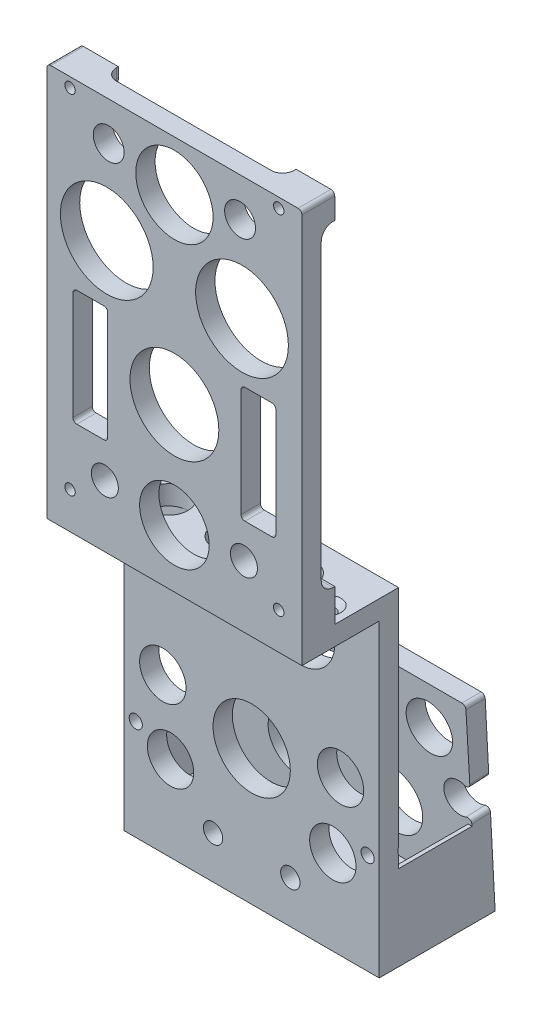
from build123d import *

# Parameters (mm, degrees)
BOSS_EXTRUDE1_DEPTH                            = 33
BOSS_EXTRUDE1_DEPTH_BACK                       = 33
CSK_FOR_M3_COUNTERSUNK_FLAT_HEAD_SCR_2_COUNT   = 2
CSK_FOR_M3_COUNTERSUNK_FLAT_HEAD_SCR_2_PITCH   = 60
CUT_EXTRUDE1_REACH                             = 192.096
SKETCH4_R                                      = 4
SKETCH4_R_2                                    = 10
SKETCH4_R_3                                    = 6
SKETCH4_R_4                                    = 7.5
CUT_EXTRUDE2_REACH                             = 108.761
SKETCH5_R                                      = 5
CUT_EXTRUDE3_REACH                             = 193.606
SKETCH6_W                                      = 9
SKETCH6_H                                      = 30
BOSS_EXTRUDE2_DEPTH                            = 3.5
FILLET1_R                                      = 3
FILLET1_OF_MIRROR1_R                           = 3
SKETCH9_R                                      = 1.35
CUT_EXTRUDE4_DEPTH                             = 190.565951584
CUT_EXTRUDE5_REACH                             = 188.649
SKETCH10_R                                     = 10
SKETCH10_R_2                                   = 6
SKETCH10_R_3                                   = 9
SKETCH10_R_4                                   = 2.5
CUT_EXTRUDE6_REACH                             = 193.606
SKETCH11_R                                     = 10
SKETCH11_R_2                                   = 11.5
SKETCH11_R_3                                   = 12
SKETCH11_R_4                                   = 9
SKETCH11_R_5                                   = 4
SKETCH11_R_6                                   = 3.5
FILLET2_R                                      = 1
FILLET3_R                                      = 1
FRAISAGE_POUR_VIS_T_TE_FRAIS_E_M31_D           = 3.4
FRAISAGE_POUR_VIS_T_TE_FRAIS_E_M31_CSINK_D     = 6.3
FRAISAGE_POUR_VIS_T_TE_FRAIS_E_M31_CSINK_ANGLE = 90
BOSS_EXTRU_1_DEPTH                             = 1


with BuildPart() as part:
    # Sketch1 → Boss-Extrude1 (new, two sides: drawn at the far end of the back side and taken through both)
    with BuildSketch(Plane(origin=(0, 0, 0), x_dir=(0, 0, -1), z_dir=(1, 0, 0)).offset(-BOSS_EXTRUDE1_DEPTH_BACK)):
        Polygon((0, 0), (30, 0), (27.383202188, 49.931476738), (22.383202188, 49.931476738), (25, 5), (5, 5), (5, 85), (-15, 85), (-15, 182), (-20, 182), (-20, 80), (0, 80), align=None)
    extrude(amount=BOSS_EXTRUDE1_DEPTH + BOSS_EXTRUDE1_DEPTH_BACK)

    # Sketch2 → CSK for M3 Countersunk Flat Head Screw1 (revolve, cut)
    with BuildSketch(Plane(origin=(30, 26, -5), x_dir=(0, 1, 0), z_dir=(1, 0, 0))):
        Polygon((0, 0), (0, 25), (1.7, 25), (1.7, 1.45), (3.15, 0), align=None)
    csk_for_m3_countersunk_flat_head_screw1 = revolve(axis=Axis((30, 26, -11.35), (0, 0, 1)), mode=Mode.SUBTRACT)

    # CSK for M3 Countersunk Flat Head Scr 2: CSK for M3 Countersunk Flat Head Screw1 ×2
    with Locations(*[(-i * CSK_FOR_M3_COUNTERSUNK_FLAT_HEAD_SCR_2_PITCH, 0, 0) for i in range(1, CSK_FOR_M3_COUNTERSUNK_FLAT_HEAD_SCR_2_COUNT)]):
        add(csk_for_m3_countersunk_flat_head_screw1, mode=Mode.SUBTRACT)

    # Cut-Extrude1: up to this plane
    cut_extrude1_end = Plane(origin=(-33, 49.931476738, -22.383202188), z_dir=(0, -0.058141226221753155, 0.9983083680974687))
    # Sketch4 → Cut-Extrude1 (cut, up to the surface)
    with BuildSketch(Plane(origin=(0, 1.567926949, -29.917828431), x_dir=(-1, 0, 0), z_dir=(0, 0.05233595624294443, -0.9986295347545739)), mode=Mode.PRIVATE) as cut_extrude1_sk1:
        with Locations((-30, 25.778575259)):
            Circle(SKETCH4_R)
    cut_extrude1_tool1 = split(extrude(cut_extrude1_sk1.sketch, amount=-CUT_EXTRUDE1_REACH, mode=Mode.PRIVATE), bisect_by=cut_extrude1_end, keep=Keep.BOTH, mode=Mode.PRIVATE)
    add(cut_extrude1_tool1.solids().sort_by_distance((30, 27.311174, -28.568682))[0], mode=Mode.SUBTRACT)
    # Sketch4 → Cut-Extrude1 (cut, up to the surface)
    with BuildSketch(Plane(origin=(0, 1.567926949, -29.917828431), x_dir=(-1, 0, 0), z_dir=(0, 0.05233595624294443, -0.9986295347545739)), mode=Mode.PRIVATE) as cut_extrude1_sk2:
        with Locations((30, 25.778575259)):
            Circle(SKETCH4_R)
    cut_extrude1_tool2 = split(extrude(cut_extrude1_sk2.sketch, amount=-CUT_EXTRUDE1_REACH, mode=Mode.PRIVATE), bisect_by=cut_extrude1_end, keep=Keep.BOTH, mode=Mode.PRIVATE)
    add(cut_extrude1_tool2.solids().sort_by_distance((-30, 27.311174, -28.568682))[0], mode=Mode.SUBTRACT)
    # Sketch4 → Cut-Extrude1 (cut, up to the surface)
    with BuildSketch(Plane(origin=(0, 1.567926949, -29.917828431), x_dir=(-1, 0, 0), z_dir=(0, 0.05233595624294443, -0.9986295347545739)), mode=Mode.PRIVATE) as cut_extrude1_sk3:
        with Locations(Location((0, 33.429921313, 0), (0, 0, 90))):
            Circle(SKETCH4_R_2)
    cut_extrude1_tool3 = split(extrude(cut_extrude1_sk3.sketch, amount=-CUT_EXTRUDE1_REACH, mode=Mode.PRIVATE), bisect_by=cut_extrude1_end, keep=Keep.BOTH, mode=Mode.PRIVATE)
    add(cut_extrude1_tool3.solids().sort_by_distance((0, 34.952034, -28.168242))[0], mode=Mode.SUBTRACT)
    # Sketch4 → Cut-Extrude1 (cut, up to the surface)
    with BuildSketch(Plane(origin=(0, 1.567926949, -29.917828431), x_dir=(-1, 0, 0), z_dir=(0, 0.05233595624294443, -0.9986295347545739)), mode=Mode.PRIVATE) as cut_extrude1_sk4:
        with Locations(Location((-23, 38.429921313, 0), (0, 0, 90))):
            Circle(SKETCH4_R_3)
    cut_extrude1_tool4 = split(extrude(cut_extrude1_sk4.sketch, amount=-CUT_EXTRUDE1_REACH, mode=Mode.PRIVATE), bisect_by=cut_extrude1_end, keep=Keep.BOTH, mode=Mode.PRIVATE)
    add(cut_extrude1_tool4.solids().sort_by_distance((23, 39.945181, -27.906562))[0], mode=Mode.SUBTRACT)
    # Sketch4 → Cut-Extrude1 (cut, up to the surface)
    with BuildSketch(Plane(origin=(0, 1.567926949, -29.917828431), x_dir=(-1, 0, 0), z_dir=(0, 0.05233595624294443, -0.9986295347545739)), mode=Mode.PRIVATE) as cut_extrude1_sk5:
        with Locations(Location((23, 38.429921313, 0), (0, 0, 90))):
            Circle(SKETCH4_R_3)
    cut_extrude1_tool5 = split(extrude(cut_extrude1_sk5.sketch, amount=-CUT_EXTRUDE1_REACH, mode=Mode.PRIVATE), bisect_by=cut_extrude1_end, keep=Keep.BOTH, mode=Mode.PRIVATE)
    add(cut_extrude1_tool5.solids().sort_by_distance((-23, 39.945181, -27.906562))[0], mode=Mode.SUBTRACT)
    # Sketch4 → Cut-Extrude1 (cut, up to the surface)
    with BuildSketch(Plane(origin=(0, 1.567926949, -29.917828431), x_dir=(-1, 0, 0), z_dir=(0, 0.05233595624294443, -0.9986295347545739)), mode=Mode.PRIVATE) as cut_extrude1_sk6:
        with Locations(Location((12.5, 16.429921313, 0), (0, 0, 90))):
            Circle(SKETCH4_R_4)
    cut_extrude1_tool6 = split(extrude(cut_extrude1_sk6.sketch, amount=-CUT_EXTRUDE1_REACH, mode=Mode.PRIVATE), bisect_by=cut_extrude1_end, keep=Keep.BOTH, mode=Mode.PRIVATE)
    add(cut_extrude1_tool6.solids().sort_by_distance((-12.5, 17.975332, -29.057953))[0], mode=Mode.SUBTRACT)
    # Sketch4 → Cut-Extrude1 (cut, up to the surface)
    with BuildSketch(Plane(origin=(0, 1.567926949, -29.917828431), x_dir=(-1, 0, 0), z_dir=(0, 0.05233595624294443, -0.9986295347545739)), mode=Mode.PRIVATE) as cut_extrude1_sk7:
        with Locations(Location((-12.5, 16.429921313, 0), (0, 0, 90))):
            Circle(SKETCH4_R_4)
    cut_extrude1_tool7 = split(extrude(cut_extrude1_sk7.sketch, amount=-CUT_EXTRUDE1_REACH, mode=Mode.PRIVATE), bisect_by=cut_extrude1_end, keep=Keep.BOTH, mode=Mode.PRIVATE)
    add(cut_extrude1_tool7.solids().sort_by_distance((12.5, 17.975332, -29.057953))[0], mode=Mode.SUBTRACT)
    # Sketch4 → Cut-Extrude1 (cut, up to the surface)
    with BuildSketch(Plane(origin=(0, 1.567926949, -29.917828431), x_dir=(-1, 0, 0), z_dir=(0, 0.05233595624294443, -0.9986295347545739)), mode=Mode.PRIVATE) as cut_extrude1_sk8:
        with Locations(Location((0, 8.429921313, 0), (0, 0, 90))):
            Circle(SKETCH4_R)
    cut_extrude1_tool8 = split(extrude(cut_extrude1_sk8.sketch, amount=-CUT_EXTRUDE1_REACH, mode=Mode.PRIVATE), bisect_by=cut_extrude1_end, keep=Keep.BOTH, mode=Mode.PRIVATE)
    add(cut_extrude1_tool8.solids().sort_by_distance((0, 9.986295, -29.47664))[0], mode=Mode.SUBTRACT)

    # Sketch5 → Cut-Extrude2 (cut, up to next)
    with BuildSketch(Plane(origin=(0, 85, 0), x_dir=(1, 0, 0), z_dir=(0, 1, 0)), mode=Mode.PRIVATE) as cut_extrude2_sk1:
        with Locations(Location((16.5, -5, 0), (0, 0, 270))):
            Circle(SKETCH5_R)
    cut_extrude2_tool1 = extrude(cut_extrude2_sk1.sketch, amount=-CUT_EXTRUDE2_REACH, mode=Mode.PRIVATE) & part.part
    # Sketch5 → Cut-Extrude2 (cut, up to next)
    with BuildSketch(Plane(origin=(0, 85, 0), x_dir=(1, 0, 0), z_dir=(0, 1, 0)), mode=Mode.PRIVATE) as cut_extrude2_sk2:
        with Locations(Location((-16.5, -5, 0), (0, 0, 270))):
            Circle(SKETCH5_R)
    cut_extrude2_tool2 = extrude(cut_extrude2_sk2.sketch, amount=-CUT_EXTRUDE2_REACH, mode=Mode.PRIVATE) & part.part
    # Sketch5 → Cut-Extrude2 (cut, up to next)
    with BuildSketch(Plane(origin=(0, 85, 0), x_dir=(1, 0, 0), z_dir=(0, 1, 0)), mode=Mode.PRIVATE) as cut_extrude2_sk3:
        with Locations(Location((0, -5, 0), (0, 0, 270))):
            Circle(SKETCH5_R)
    cut_extrude2_tool3 = extrude(cut_extrude2_sk3.sketch, amount=-CUT_EXTRUDE2_REACH, mode=Mode.PRIVATE) & part.part
    add(cut_extrude2_tool1.solids().sort_by_distance((16.5, 85, 5))[0], mode=Mode.SUBTRACT)
    add(cut_extrude2_tool2.solids().sort_by_distance((-16.5, 85, 5))[0], mode=Mode.SUBTRACT)
    add(cut_extrude2_tool3.solids().sort_by_distance((0, 85, 5))[0], mode=Mode.SUBTRACT)

    # Sketch6 → Cut-Extrude3 (cut, up to next)
    with BuildSketch(Plane.XY.offset(20), mode=Mode.PRIVATE) as cut_extrude3_sk1:
        with Locations((21.75, 120)):
            Rectangle(SKETCH6_W, SKETCH6_H)
    cut_extrude3_tool1 = extrude(cut_extrude3_sk1.sketch, amount=-CUT_EXTRUDE3_REACH, mode=Mode.PRIVATE) & part.part
    # Sketch6 → Cut-Extrude3 (cut, up to next)
    with BuildSketch(Plane.XY.offset(20), mode=Mode.PRIVATE) as cut_extrude3_sk2:
        with Locations((-21.75, 120)):
            Rectangle(SKETCH6_W, SKETCH6_H)
    cut_extrude3_tool2 = extrude(cut_extrude3_sk2.sketch, amount=-CUT_EXTRUDE3_REACH, mode=Mode.PRIVATE) & part.part
    add(cut_extrude3_tool1.solids().sort_by_distance((21.75, 120, 20))[0], mode=Mode.SUBTRACT)
    add(cut_extrude3_tool2.solids().sort_by_distance((-21.75, 120, 20))[0], mode=Mode.SUBTRACT)

    # Sketch8 → Boss-Extrude2 (add)
    with BuildSketch(Plane(origin=(0, 0, 15), x_dir=(-1, 0, 0), z_dir=(0, 0, -1))):
        with BuildLine():
            Line((-33, 85), (-23, 85))
            Line((-23, 85), (-23, 89.5))
            ThreePointArc((-23, 89.5), (-24.171572875, 92.328427125), (-27, 93.5))
            Line((-27, 93.5), (-33, 93.5))
            Line((-33, 93.5), (-33, 85))
        make_face()
        with BuildLine():
            Line((-33, 175.5), (-27, 175.5))
            ThreePointArc((-27, 175.5), (-24.171572875, 176.671572875), (-23, 179.5))
            Line((-23, 179.5), (-23, 182))
            Line((-23, 182), (-33, 182))
            Line((-33, 182), (-33, 175.5))
        make_face()
    boss_extrude2 = extrude(amount=BOSS_EXTRUDE2_DEPTH)

    # Fillet1
    fillet1_edges = [part.edges().sort_by_distance(p)[0] for p in [
        (30, 93.5, 15),
        (24.171572875, 92.328427125, 15),
        (23, 87.25, 15),
        (23, 180.75, 15),
        (24.171572875, 176.671572875, 15),
        (30, 175.5, 15),
    ]]
    fillet(fillet1_edges, radius=FILLET1_R)

    # Mirror1: Boss-Extrude2 across plane
    add(boss_extrude2.mirror(Plane(origin=(0, 0, 0), x_dir=(0, 0, 1), z_dir=(1, 0, 0))))

    # Fillet1 of Mirror1
    fillet1_of_mirror1_edges = [part.edges().sort_by_distance(p)[0] for p in [
        (-30, 93.5, 15),
        (-24.171572875, 92.328427125, 15),
        (-23, 87.25, 15),
        (-23, 180.75, 15),
        (-24.171572875, 176.671572875, 15),
        (-30, 175.5, 15),
    ]]
    fillet(fillet1_of_mirror1_edges, radius=FILLET1_OF_MIRROR1_R)

    # Sketch9 → Cut-Extrude4 (cut, through all)
    with BuildSketch(Plane(origin=(0, 0, 11.5), x_dir=(-1, 0, 0), z_dir=(0, 0, -1))):
        with Locations(Location((27, 89.5, 0), (0, 0, 90))):
            Circle(SKETCH9_R)
        with Locations(Location((-27, 89.5, 0), (0, 0, 90))):
            Circle(SKETCH9_R)
        with Locations(Location((-27, 179.5, 0), (0, 0, 90))):
            Circle(SKETCH9_R)
        with Locations(Location((27, 179.5, 0), (0, 0, 90))):
            Circle(SKETCH9_R)
    extrude(amount=-CUT_EXTRUDE4_DEPTH, mode=Mode.SUBTRACT)

    # Sketch10 → Cut-Extrude5 (cut, up to next)
    with BuildSketch(Plane(origin=(0, 0, -5), x_dir=(-1, 0, 0), z_dir=(0, 0, -1)), mode=Mode.PRIVATE) as cut_extrude5_sk1:
        with Locations((0, 34.952033716)):
            Circle(SKETCH10_R)
    cut_extrude5_tool1 = extrude(cut_extrude5_sk1.sketch, amount=-CUT_EXTRUDE5_REACH, mode=Mode.PRIVATE) & part.part
    # Sketch10 → Cut-Extrude5 (cut, up to next)
    with BuildSketch(Plane(origin=(0, 0, -5), x_dir=(-1, 0, 0), z_dir=(0, 0, -1)), mode=Mode.PRIVATE) as cut_extrude5_sk2:
        with Locations((-23, 39.94518139)):
            Circle(SKETCH10_R_2)
    cut_extrude5_tool2 = extrude(cut_extrude5_sk2.sketch, amount=-CUT_EXTRUDE5_REACH, mode=Mode.PRIVATE) & part.part
    # Sketch10 → Cut-Extrude5 (cut, up to next)
    with BuildSketch(Plane(origin=(0, 0, -5), x_dir=(-1, 0, 0), z_dir=(0, 0, -1)), mode=Mode.PRIVATE) as cut_extrude5_sk3:
        with Locations((23, 39.94518139)):
            Circle(SKETCH10_R_2)
    cut_extrude5_tool3 = extrude(cut_extrude5_sk3.sketch, amount=-CUT_EXTRUDE5_REACH, mode=Mode.PRIVATE) & part.part
    # Sketch10 → Cut-Extrude5 (cut, up to next)
    with BuildSketch(Plane(origin=(0, 0, -5), x_dir=(-1, 0, 0), z_dir=(0, 0, -1)), mode=Mode.PRIVATE) as cut_extrude5_sk4:
        with Locations((-12.5, 69)):
            Circle(SKETCH10_R_3)
    cut_extrude5_tool4 = extrude(cut_extrude5_sk4.sketch, amount=-CUT_EXTRUDE5_REACH, mode=Mode.PRIVATE) & part.part
    # Sketch10 → Cut-Extrude5 (cut, up to next)
    with BuildSketch(Plane(origin=(0, 0, -5), x_dir=(-1, 0, 0), z_dir=(0, 0, -1)), mode=Mode.PRIVATE) as cut_extrude5_sk5:
        with Locations((12.5, 69)):
            Circle(SKETCH10_R_3)
    cut_extrude5_tool5 = extrude(cut_extrude5_sk5.sketch, amount=-CUT_EXTRUDE5_REACH, mode=Mode.PRIVATE) & part.part
    # Sketch10 → Cut-Extrude5 (cut, up to next)
    with BuildSketch(Plane(origin=(0, 0, -5), x_dir=(-1, 0, 0), z_dir=(0, 0, -1)), mode=Mode.PRIVATE) as cut_extrude5_sk6:
        with Locations((-21, 22)):
            Circle(SKETCH10_R_2)
    cut_extrude5_tool6 = extrude(cut_extrude5_sk6.sketch, amount=-CUT_EXTRUDE5_REACH, mode=Mode.PRIVATE) & part.part
    # Sketch10 → Cut-Extrude5 (cut, up to next)
    with BuildSketch(Plane(origin=(0, 0, -5), x_dir=(-1, 0, 0), z_dir=(0, 0, -1)), mode=Mode.PRIVATE) as cut_extrude5_sk7:
        with Locations((21, 22)):
            Circle(SKETCH10_R_2)
    cut_extrude5_tool7 = extrude(cut_extrude5_sk7.sketch, amount=-CUT_EXTRUDE5_REACH, mode=Mode.PRIVATE) & part.part
    # Sketch10 → Cut-Extrude5 (cut, up to next)
    with BuildSketch(Plane(origin=(0, 0, -5), x_dir=(-1, 0, 0), z_dir=(0, 0, -1)), mode=Mode.PRIVATE) as cut_extrude5_sk8:
        with Locations((-10, 11)):
            Circle(SKETCH10_R_4)
    cut_extrude5_tool8 = extrude(cut_extrude5_sk8.sketch, amount=-CUT_EXTRUDE5_REACH, mode=Mode.PRIVATE) & part.part
    # Sketch10 → Cut-Extrude5 (cut, up to next)
    with BuildSketch(Plane(origin=(0, 0, -5), x_dir=(-1, 0, 0), z_dir=(0, 0, -1)), mode=Mode.PRIVATE) as cut_extrude5_sk9:
        with Locations((10, 11)):
            Circle(SKETCH10_R_4)
    cut_extrude5_tool9 = extrude(cut_extrude5_sk9.sketch, amount=-CUT_EXTRUDE5_REACH, mode=Mode.PRIVATE) & part.part
    add(cut_extrude5_tool1.solids().sort_by_distance((0, 34.952034, -5))[0], mode=Mode.SUBTRACT)
    add(cut_extrude5_tool2.solids().sort_by_distance((23, 39.945181, -5))[0], mode=Mode.SUBTRACT)
    add(cut_extrude5_tool3.solids().sort_by_distance((-23, 39.945181, -5))[0], mode=Mode.SUBTRACT)
    add(cut_extrude5_tool4.solids().sort_by_distance((12.5, 69, -5))[0], mode=Mode.SUBTRACT)
    add(cut_extrude5_tool5.solids().sort_by_distance((-12.5, 69, -5))[0], mode=Mode.SUBTRACT)
    add(cut_extrude5_tool6.solids().sort_by_distance((21, 22, -5))[0], mode=Mode.SUBTRACT)
    add(cut_extrude5_tool7.solids().sort_by_distance((-21, 22, -5))[0], mode=Mode.SUBTRACT)
    add(cut_extrude5_tool8.solids().sort_by_distance((10, 11, -5))[0], mode=Mode.SUBTRACT)
    add(cut_extrude5_tool9.solids().sort_by_distance((-10, 11, -5))[0], mode=Mode.SUBTRACT)

    # Sketch11 → Cut-Extrude6 (cut, up to next)
    with BuildSketch(Plane.XY.offset(20), mode=Mode.PRIVATE) as cut_extrude6_sk1:
        with Locations((0, 169)):
            Circle(SKETCH11_R)
    cut_extrude6_tool1 = extrude(cut_extrude6_sk1.sketch, amount=-CUT_EXTRUDE6_REACH, mode=Mode.PRIVATE) & part.part
    # Sketch11 → Cut-Extrude6 (cut, up to next)
    with BuildSketch(Plane.XY.offset(20), mode=Mode.PRIVATE) as cut_extrude6_sk2:
        with Locations((0, 122)):
            Circle(SKETCH11_R_2)
    cut_extrude6_tool2 = extrude(cut_extrude6_sk2.sketch, amount=-CUT_EXTRUDE6_REACH, mode=Mode.PRIVATE) & part.part
    # Sketch11 → Cut-Extrude6 (cut, up to next)
    with BuildSketch(Plane.XY.offset(20), mode=Mode.PRIVATE) as cut_extrude6_sk3:
        with Locations((-17.5, 150)):
            Circle(SKETCH11_R_3)
    cut_extrude6_tool3 = extrude(cut_extrude6_sk3.sketch, amount=-CUT_EXTRUDE6_REACH, mode=Mode.PRIVATE) & part.part
    # Sketch11 → Cut-Extrude6 (cut, up to next)
    with BuildSketch(Plane.XY.offset(20), mode=Mode.PRIVATE) as cut_extrude6_sk4:
        with Locations((17.5, 150)):
            Circle(SKETCH11_R_3)
    cut_extrude6_tool4 = extrude(cut_extrude6_sk4.sketch, amount=-CUT_EXTRUDE6_REACH, mode=Mode.PRIVATE) & part.part
    # Sketch11 → Cut-Extrude6 (cut, up to next)
    with BuildSketch(Plane.XY.offset(20), mode=Mode.PRIVATE) as cut_extrude6_sk5:
        with Locations((0, 95)):
            Circle(SKETCH11_R_4)
    cut_extrude6_tool5 = extrude(cut_extrude6_sk5.sketch, amount=-CUT_EXTRUDE6_REACH, mode=Mode.PRIVATE) & part.part
    # Sketch11 → Cut-Extrude6 (cut, up to next)
    with BuildSketch(Plane.XY.offset(20), mode=Mode.PRIVATE) as cut_extrude6_sk6:
        with Locations((-17, 172)):
            Circle(SKETCH11_R_5)
    cut_extrude6_tool6 = extrude(cut_extrude6_sk6.sketch, amount=-CUT_EXTRUDE6_REACH, mode=Mode.PRIVATE) & part.part
    # Sketch11 → Cut-Extrude6 (cut, up to next)
    with BuildSketch(Plane.XY.offset(20), mode=Mode.PRIVATE) as cut_extrude6_sk7:
        with Locations((17, 172)):
            Circle(SKETCH11_R_5)
    cut_extrude6_tool7 = extrude(cut_extrude6_sk7.sketch, amount=-CUT_EXTRUDE6_REACH, mode=Mode.PRIVATE) & part.part
    # Sketch11 → Cut-Extrude6 (cut, up to next)
    with BuildSketch(Plane.XY.offset(20), mode=Mode.PRIVATE) as cut_extrude6_sk8:
        with Locations((18, 96)):
            Circle(SKETCH11_R_6)
    cut_extrude6_tool8 = extrude(cut_extrude6_sk8.sketch, amount=-CUT_EXTRUDE6_REACH, mode=Mode.PRIVATE) & part.part
    # Sketch11 → Cut-Extrude6 (cut, up to next)
    with BuildSketch(Plane.XY.offset(20), mode=Mode.PRIVATE) as cut_extrude6_sk9:
        with Locations((-18, 96)):
            Circle(SKETCH11_R_6)
    cut_extrude6_tool9 = extrude(cut_extrude6_sk9.sketch, amount=-CUT_EXTRUDE6_REACH, mode=Mode.PRIVATE) & part.part
    add(cut_extrude6_tool1.solids().sort_by_distance((0, 169, 20))[0], mode=Mode.SUBTRACT)
    add(cut_extrude6_tool2.solids().sort_by_distance((0, 122, 20))[0], mode=Mode.SUBTRACT)
    add(cut_extrude6_tool3.solids().sort_by_distance((-17.5, 150, 20))[0], mode=Mode.SUBTRACT)
    add(cut_extrude6_tool4.solids().sort_by_distance((17.5, 150, 20))[0], mode=Mode.SUBTRACT)
    add(cut_extrude6_tool5.solids().sort_by_distance((0, 95, 20))[0], mode=Mode.SUBTRACT)
    add(cut_extrude6_tool6.solids().sort_by_distance((-17, 172, 20))[0], mode=Mode.SUBTRACT)
    add(cut_extrude6_tool7.solids().sort_by_distance((17, 172, 20))[0], mode=Mode.SUBTRACT)
    add(cut_extrude6_tool8.solids().sort_by_distance((18, 96, 20))[0], mode=Mode.SUBTRACT)
    add(cut_extrude6_tool9.solids().sort_by_distance((-18, 96, 20))[0], mode=Mode.SUBTRACT)

    # Fillet2
    fillet2_edges = [part.edges().sort_by_distance(p)[0] for p in [
        (-33, 49.931476738, -24.883202188),
        (-33, 182, 15.75),
        (33, 49.931476738, -24.883202188),
        (33, 182, 15.75),
        (33, 24.542276263, -26.288197959),
        (33, 29.825721981, -25.995900208),
        (-33, 24.542276263, -26.288197959),
        (-33, 29.825721981, -25.995900208),
    ]]
    fillet(fillet2_edges, radius=FILLET2_R)

    # Fillet3
    fillet3_edges = [part.edges().sort_by_distance(p)[0] for p in [
        (26.25, 135, 17.5),
        (26.25, 105, 17.5),
        (17.25, 105, 17.5),
        (17.25, 135, 17.5),
        (-17.25, 135, 17.5),
        (-17.25, 105, 17.5),
        (-26.25, 105, 17.5),
        (-26.25, 135, 17.5),
    ]]
    fillet(fillet3_edges, radius=FILLET3_R)

    # Fraisage pour vis à tête fraisée M31 (through all)
    with Locations(Plane(origin=(0, 85, 0), x_dir=(1, 0, 0), z_dir=(0, 1, 0))):
        with Locations((28, -8)):
            fraisage_pour_vis_t_te_frais_e_m31 = CounterSinkHole(FRAISAGE_POUR_VIS_T_TE_FRAIS_E_M31_D / 2, FRAISAGE_POUR_VIS_T_TE_FRAIS_E_M31_CSINK_D / 2, counter_sink_angle=FRAISAGE_POUR_VIS_T_TE_FRAIS_E_M31_CSINK_ANGLE)

    # Symétrie1: Fraisage pour vis à tête fraisée M31 across plane
    add(fraisage_pour_vis_t_te_frais_e_m31.mirror(Plane(origin=(0, 0, 0), x_dir=(0, 0, 1), z_dir=(1, 0, 0))), mode=Mode.SUBTRACT)

    # Esquisse3 → Boss.-Extru.1 (add)
    with BuildSketch(Plane(origin=(33, 0, 0), x_dir=(0, 0, -1), z_dir=(1, 0, 0))):
        Polygon((5, 5), (24.068309706, 5), (25.54744801, 5), (24.009924311, 22), (5, 22), align=None)
    boss_extru_1 = extrude(amount=-BOSS_EXTRU_1_DEPTH)

    # Symétrie2: Boss.-Extru.1 across plane
    add(boss_extru_1.mirror(Plane(origin=(0, 0, 0), x_dir=(0, 0, 1), z_dir=(1, 0, 0))))


solid = part.part
